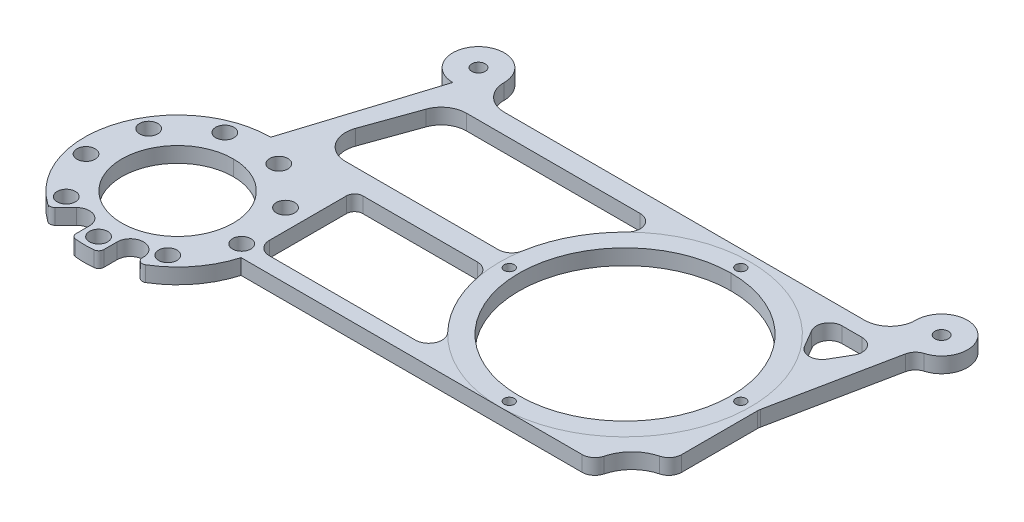
from build123d import *

# Parameters (mm, degrees)
SKETCH5_R           = 2.5
SKETCH5_R_2         = 52.3875
SKETCH5_R_3         = 4.5
SKETCH5_R_4         = 27.4955
BOSS_EXTRUDE2_DEPTH = 7.62
CUT_EXTRUDE1_REACH  = 239.718
SKETCH7_R           = 3.302
CUT_EXTRUDE2_REACH  = 239.718
FILLET1_R           = 6.35
CUT_EXTRUDE18_REACH = 239.718
CUT_EXTRUDE22_REACH = 239.718
CUT_EXTRUDE23_REACH = 239.718
CUT_EXTRUDE24_REACH = 239.718
FILLET2_R           = 6.35


with BuildPart() as part:
    # Sketch5 → Boss-Extrude2 (new body)
    with BuildSketch(Plane(origin=(0, 0, 0), x_dir=(-1, 0, 0), z_dir=(0, 1, 0))):
        with BuildLine():
            ThreePointArc((-65.654330467, 67.1325302), (-87.334586589, 76.112786321), (-78.354330467, 54.4325302))
            Line((-78.354330467, 54.4325302), (-78.354330467, -65.2014698))
            ThreePointArc((-78.354330467, -65.2014698), (-87.334586589, -86.881725921), (-65.654330467, -77.9014698))
            ThreePointArc((-65.654330467, -77.9014698), (-61.934586589, -68.921213679), (-52.954330467, -65.2014698))
            Line((-52.954330467, -65.2014698), (124.845669533, -65.2014698))
            ThreePointArc((124.845669533, -65.2014698), (133.825925654, -68.921213679), (137.545669533, -77.9014698))
            ThreePointArc((137.545669533, -77.9014698), (159.225925654, -86.881725921), (150.245669533, -65.2014698))
            Line((150.245669533, -65.2014698), (171.77131, 3.1242))
            ThreePointArc((171.77131, 3.1242), (215.601286514, 35.222255536), (198.228973896, 86.696081552))
            ThreePointArc((198.228973896, 86.696081552), (196.548809881, 87.149442365), (194.971173285, 86.414901751))
            Line((194.971173285, 86.414901751), (189.706289667, 81.150018133))
            ThreePointArc((189.706289667, 81.150018133), (182.622653279, 79.740995249), (178.61009559, 85.746212211))
            Line((178.61009559, 85.746212211), (178.61009559, 92.318945001))
            ThreePointArc((178.61009559, 92.318945001), (177.952930296, 94.023800851), (176.32148656, 94.846473949))
            ThreePointArc((176.32148656, 94.846473949), (171.77131, 95.0722), (167.22113344, 94.846473949))
            ThreePointArc((167.22113344, 94.846473949), (165.589689704, 94.023800851), (164.93252441, 92.318945001))
            Line((164.93252441, 92.318945001), (164.93252441, 85.746212211))
            ThreePointArc((164.93252441, 85.746212211), (158.43252441, 79.246212211), (151.93252441, 85.746212211))
            Line((151.93252441, 85.746212211), (151.93252441, 86.323222653))
            ThreePointArc((151.93252441, 86.323222653), (150.643024247, 88.534070942), (148.083823499, 88.500124563))
            Line((148.083823499, 88.500124563), (0, 61.9125))
            Line((0, 61.9125), (-65.654330467, 67.1325302))
        make_face()
        with Locations(Location((0, -57.15, 0), (0, 0, 90))):
            Circle(SKETCH5_R, mode=Mode.SUBTRACT)
        with Locations(Location((-57.15, 0, 0), (0, 0, 90))):
            Circle(SKETCH5_R, mode=Mode.SUBTRACT)
        with Locations(Location((0, 0, 0), (0, 0, 90))):
            Circle(SKETCH5_R_2, mode=Mode.SUBTRACT)
        with Locations(Location((57.15, 0, 0), (0, 0, 90))):
            Circle(SKETCH5_R, mode=Mode.SUBTRACT)
        with Locations(Location((158.432556474, 12.450347008, 0), (0, 0, 90))):
            Circle(SKETCH5_R_3, mode=Mode.SUBTRACT)
        with Locations(Location((185.110017809, 12.450330368, 0), (0, 0, 90))):
            Circle(SKETCH5_R_3, mode=Mode.SUBTRACT)
        with Locations(Location((0, 57.15, 0), (0, 0, 90))):
            Circle(SKETCH5_R, mode=Mode.SUBTRACT)
        with Locations(Location((137.996446159, 29.598301358, 0), (0, 0, 90))):
            Circle(SKETCH5_R_3, mode=Mode.SUBTRACT)
        with Locations(Location((205.546149516, 29.598259225, 0), (0, 0, 90))):
            Circle(SKETCH5_R_3, mode=Mode.SUBTRACT)
        with Locations(Location((171.77131, 49.0982, 0), (0, 0, 90))):
            Circle(SKETCH5_R_4, mode=Mode.SUBTRACT)
        with Locations(Location((133.36397, 55.870475, 0), (0, 0, 90))):
            Circle(SKETCH5_R_3, mode=Mode.SUBTRACT)
        with Locations(Location((210.178658448, 55.870427088, 0), (0, 0, 90))):
            Circle(SKETCH5_R_3, mode=Mode.SUBTRACT)
        with Locations(Location((146.702715077, 78.973825904, 0), (0, 0, 90))):
            Circle(SKETCH5_R_3, mode=Mode.SUBTRACT)
        with Locations(Location((171.771334325, 88.098039417, 0), (0, 0, 90))):
            Circle(SKETCH5_R_3, mode=Mode.SUBTRACT)
        with Locations(Location((196.839942191, 78.973794632, 0), (0, 0, 90))):
            Circle(SKETCH5_R_3, mode=Mode.SUBTRACT)
    extrude(amount=BOSS_EXTRUDE2_DEPTH)

    # Sketch7 → Cut-Extrude1 (cut, up to next)
    with BuildSketch(Plane(origin=(0, 7.62, 0), x_dir=(1, 0, 0), z_dir=(0, 1, 0)), mode=Mode.PRIVATE) as cut_extrude1_sk1:
        with Locations(Location((78.354330467, 77.9014698, 0), (0, 0, 270))):
            Circle(SKETCH7_R)
    cut_extrude1_tool1 = extrude(cut_extrude1_sk1.sketch, amount=-CUT_EXTRUDE1_REACH, mode=Mode.PRIVATE) & part.part
    # Sketch7 → Cut-Extrude1 (cut, up to next)
    with BuildSketch(Plane(origin=(0, 7.62, 0), x_dir=(1, 0, 0), z_dir=(0, 1, 0)), mode=Mode.PRIVATE) as cut_extrude1_sk2:
        with Locations(Location((78.354330467, -67.1325302, 0), (0, 0, 270))):
            Circle(SKETCH7_R)
    cut_extrude1_tool2 = extrude(cut_extrude1_sk2.sketch, amount=-CUT_EXTRUDE1_REACH, mode=Mode.PRIVATE) & part.part
    # Sketch7 → Cut-Extrude1 (cut, up to next)
    with BuildSketch(Plane(origin=(0, 7.62, 0), x_dir=(1, 0, 0), z_dir=(0, 1, 0)), mode=Mode.PRIVATE) as cut_extrude1_sk3:
        with Locations(Location((-150.245669533, 77.9014698, 0), (0, 0, 270))):
            Circle(SKETCH7_R)
    cut_extrude1_tool3 = extrude(cut_extrude1_sk3.sketch, amount=-CUT_EXTRUDE1_REACH, mode=Mode.PRIVATE) & part.part
    add(cut_extrude1_tool1.solids().sort_by_distance((78.35433, 7.62, -77.90147))[0], mode=Mode.SUBTRACT)
    add(cut_extrude1_tool2.solids().sort_by_distance((78.35433, 7.62, 67.13253))[0], mode=Mode.SUBTRACT)
    add(cut_extrude1_tool3.solids().sort_by_distance((-150.24567, 7.62, -77.90147))[0], mode=Mode.SUBTRACT)

    # Sketch9 → Cut-Extrude2 (cut, up to next)
    with BuildSketch(Plane(origin=(0, 7.62, 0), x_dir=(1, 0, 0), z_dir=(0, 1, 0)), mode=Mode.PRIVATE) as cut_extrude2_sk1:
        with BuildLine():
            Line((78.354330467, -54.4325302), (65.479533423, -1.373188973))
            ThreePointArc((65.479533423, -1.373188973), (65.301620926, 0.002964909), (65.426874021, 1.384907029))
            Line((65.426874021, 1.384907029), (78.354330467, 65.2014698))
            Line((78.354330467, 65.2014698), (78.354330467, -54.4325302))
        make_face()
    cut_extrude2_tool1 = extrude(cut_extrude2_sk1.sketch, amount=-CUT_EXTRUDE2_REACH, mode=Mode.PRIVATE) & part.part
    add(cut_extrude2_tool1.solids().sort_by_distance((73.953245, 7.62, -3.5903))[0], mode=Mode.SUBTRACT)

    # Fillet1
    fillet1_edges = [part.edges().sort_by_distance(p)[0] for p in [
        (78.354330467, 3.81, -65.2014698),
        (78.354330467, 3.81, 54.4325302),
    ]]
    fillet(fillet1_edges, radius=FILLET1_R)

    # Sketch18 → Cut-Extrude18 (cut, up to next)
    with BuildSketch(Plane(origin=(0, 7.62, 0), x_dir=(1, 0, 0), z_dir=(0, 1, 0)), mode=Mode.PRIVATE) as cut_extrude18_sk1:
        with BuildLine():
            Line((0, -61.9125), (-127.619272771, -61.9125))
            ThreePointArc((-127.619272771, -61.9125), (-135.339514958, -77.139829518), (-148.083823499, -88.500124563))
            Line((-148.083823499, -88.500124563), (0, -61.9125))
        make_face()
    cut_extrude18_tool1 = extrude(cut_extrude18_sk1.sketch, amount=-CUT_EXTRUDE18_REACH, mode=Mode.PRIVATE) & part.part
    add(cut_extrude18_tool1.solids().sort_by_distance((-89.926243, 7.62, 70.546245))[0], mode=Mode.SUBTRACT)

    # Sketch23 → Cut-Extrude22 (cut, up to next)
    with BuildSketch(Plane(origin=(0, 7.62, 0), x_dir=(1, 0, 0), z_dir=(0, 1, 0)), mode=Mode.PRIVATE) as cut_extrude22_sk1:
        with BuildLine():
            Line((44.404686705, 47.70167394), (49.357095568, 39.22528171))
            ThreePointArc((49.357095568, 39.22528171), (54.839881255, 36.078648861), (60.322666943, 39.22528171))
            Line((60.322666943, 39.22528171), (65.275075806, 47.70167394))
            ThreePointArc((65.275075806, 47.70167394), (65.299734236, 54.065825692), (59.792290118, 57.255041091))
            Line((59.792290118, 57.255041091), (49.887472392, 57.255041091))
            ThreePointArc((49.887472392, 57.255041091), (44.380028275, 54.065825692), (44.404686705, 47.70167394))
        make_face()
    cut_extrude22_tool1 = extrude(cut_extrude22_sk1.sketch, amount=-CUT_EXTRUDE22_REACH, mode=Mode.PRIVATE) & part.part
    add(cut_extrude22_tool1.solids().sort_by_distance((54.839881, 7.62, -48.088951))[0], mode=Mode.SUBTRACT)

    # Sketch24 → Cut-Extrude23 (cut, up to next)
    with BuildSketch(Plane(origin=(0, 7.62, 0), x_dir=(1, 0, 0), z_dir=(0, 1, 0)), mode=Mode.PRIVATE) as cut_extrude23_sk1:
        with BuildLine():
            Line((-128.021835855, -9.473541553), (-128.021835855, -47.532808157))
            ThreePointArc((-128.021835855, -47.532808157), (-126.087569038, -52.20254134), (-121.417835855, -54.136808157))
            Line((-121.417835855, -54.136808157), (-49.347167305, -54.136808157))
            ThreePointArc((-49.347167305, -54.136808157), (-43.269796158, -50.117063552), (-44.590813829, -42.951332672))
            ThreePointArc((-44.590813829, -42.951332672), (-55.149477043, -28.13703677), (-60.946622173, -10.89343389))
            ThreePointArc((-60.946622173, -10.89343389), (-63.208539256, -6.9914866), (-67.447595205, -5.451400172))
            Line((-67.447595205, -5.451400172), (-123.999694474, -5.451400172))
            ThreePointArc((-123.999694474, -5.451400172), (-126.843777919, -6.629458107), (-128.021835855, -9.473541553))
        make_face()
    cut_extrude23_tool1 = extrude(cut_extrude23_sk1.sketch, amount=-CUT_EXTRUDE23_REACH, mode=Mode.PRIVATE) & part.part
    # Sketch24 → Cut-Extrude23 (cut, up to next)
    with BuildSketch(Plane(origin=(0, 7.62, 0), x_dir=(1, 0, 0), z_dir=(0, 1, 0)), mode=Mode.PRIVATE) as cut_extrude23_sk2:
        with BuildLine():
            Line((-48.030119475, 55.467262227), (-133.757395028, 55.467262227))
            ThreePointArc((-133.757395028, 55.467262227), (-140.91596397, 53.199285335), (-145.462549697, 47.222882847))
            Line((-145.462549697, 47.222882847), (-154.629174486, 21.597614724))
            ThreePointArc((-154.629174486, 21.597614724), (-153.087569165, 10.251898923), (-142.924019817, 4.978941625))
            Line((-142.924019817, 4.978941625), (-67.530335669, 4.978941625))
            ThreePointArc((-67.530335669, 4.978941625), (-63.273580756, 6.533896803), (-61.021387653, 10.466513517))
            ThreePointArc((-61.021387653, 10.466513517), (-54.860712254, 28.695991135), (-43.400710369, 44.153550205))
            ThreePointArc((-43.400710369, 44.153550205), (-41.918010421, 51.364249812), (-48.030119475, 55.467262227))
        make_face()
    cut_extrude23_tool2 = extrude(cut_extrude23_sk2.sketch, amount=-CUT_EXTRUDE23_REACH, mode=Mode.PRIVATE) & part.part
    add(cut_extrude23_tool1.solids().sort_by_distance((-90.134227, 7.62, 31.015027))[0], mode=Mode.SUBTRACT)
    add(cut_extrude23_tool2.solids().sort_by_distance((-101.091436, 7.62, -30.758334))[0], mode=Mode.SUBTRACT)

    # Sketch25 → Cut-Extrude24 (cut, up to next)
    with BuildSketch(Plane(origin=(0, 7.62, 0), x_dir=(1, 0, 0), z_dir=(0, 1, 0)), mode=Mode.PRIVATE) as cut_extrude24_sk1:
        with BuildLine():
            Line((77.350104134, -50.293933877), (65.301620926, 0.002964909))
            Line((65.301620926, 0.002964909), (65.301620926, -42.8625))
            ThreePointArc((65.301620926, -42.8625), (51.831236744, -48.442115818), (46.251620926, -61.9125))
            Line((46.251620926, -61.9125), (0, -61.9125))
            Line((0, -61.9125), (65.654330467, -67.1325302))
            ThreePointArc((65.654330467, -67.1325302), (86.020660704, -77.257616901), (81.798799869, -54.908552511))
            ThreePointArc((81.798799869, -54.908552511), (78.949471352, -53.203752084), (77.350104134, -50.293933877))
        make_face()
    cut_extrude24_tool1 = extrude(cut_extrude24_sk1.sketch, amount=-CUT_EXTRUDE24_REACH, mode=Mode.PRIVATE) & part.part
    add(cut_extrude24_tool1.solids().sort_by_distance((67.004182, 7.62, 55.543005))[0], mode=Mode.SUBTRACT)

    # Fillet2
    fillet2_edges = [part.edges().sort_by_distance(p)[0] for p in [
        (65.301620926, 3.81, 42.8625),
        (46.251620926, 3.81, 61.9125),
    ]]
    fillet(fillet2_edges, radius=FILLET2_R)


solid = part.part
